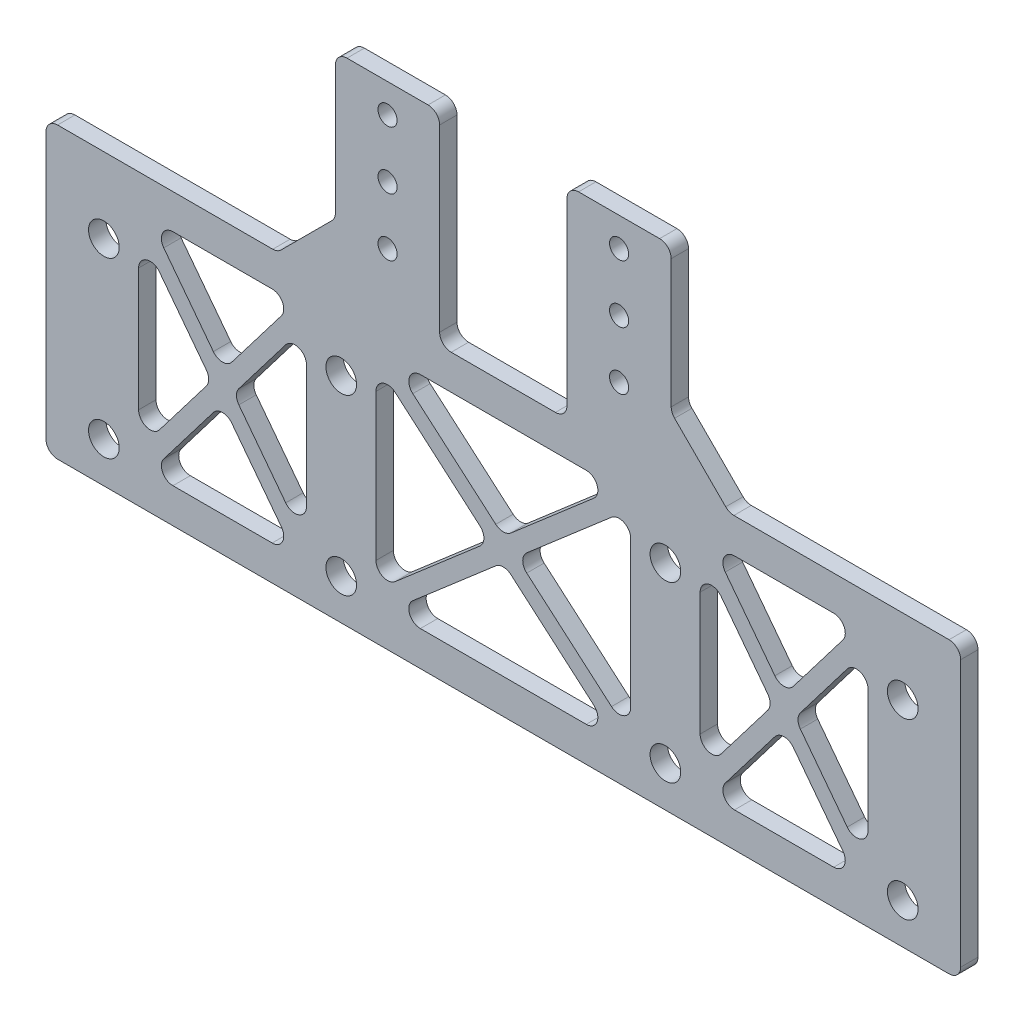
from build123d import *

# Parameters (mm, degrees)
SKETCH_1_R          = 1.55
SKETCH_1_R_2        = 2.65
SKETCH_1_W          = 29
SKETCH_1_H          = 38
SKETCH_1_W_2        = 44
EXTRUDE_1_DEPTH     = 3
SKETCH_4_W          = 20
SKETCH_4_H          = 35
CUT_EXTRUDE_1_DEPTH = 10
SKETCH_3_W          = 18
SKETCH_3_H          = 35
EXTRUDE_2_DEPTH     = 3
SKETCH_5_R          = 1.65
CUT_EXTRUDE_2_DEPTH = 5
CHAMFER_1_SIZE      = 10
FILLET_1_R          = 2
EXTRUDE_1_2_DEPTH   = 3
FILLET_3_R          = 2


with BuildPart() as part:
    # 草图1 → Extrude 1 (new body)
    with BuildSketch(Plane.XY):
        Polygon((-10, 50), (-10, 85), (10, 85), (10, 50), (79, 50), (79, 0), (-79, 0), (-79, 50), align=None)
        with Locations((-6, 81)):
            Circle(SKETCH_1_R, mode=Mode.SUBTRACT)
        with Locations(Location((6, 81, 0), (0, 0, 180))):
            Circle(SKETCH_1_R, mode=Mode.SUBTRACT)
        with Locations((-6, 59)):
            Circle(SKETCH_1_R, mode=Mode.SUBTRACT)
        with Locations(Location((6, 59, 0), (0, 0, 180))):
            Circle(SKETCH_1_R, mode=Mode.SUBTRACT)
        with Locations((-69, 37)):
            Circle(SKETCH_1_R_2, mode=Mode.SUBTRACT)
        with Locations((-69, 7)):
            Circle(SKETCH_1_R_2, mode=Mode.SUBTRACT)
        with Locations(Location((69, 7, 0), (0, 0, 180))):
            Circle(SKETCH_1_R_2, mode=Mode.SUBTRACT)
        with Locations(Location((69, 37, 0), (0, 0, 180))):
            Circle(SKETCH_1_R_2, mode=Mode.SUBTRACT)
        with Locations((-28, 37)):
            Circle(SKETCH_1_R_2, mode=Mode.SUBTRACT)
        with Locations((-28, 7)):
            Circle(SKETCH_1_R_2, mode=Mode.SUBTRACT)
        with Locations(Location((28, 7, 0), (0, 0, 180))):
            Circle(SKETCH_1_R_2, mode=Mode.SUBTRACT)
        with Locations(Location((28, 37, 0), (0, 0, 180))):
            Circle(SKETCH_1_R_2, mode=Mode.SUBTRACT)
        with Locations((-48.5, 25)):
            Rectangle(SKETCH_1_W, SKETCH_1_H, mode=Mode.SUBTRACT)
        with Locations((48.5, 25)):
            Rectangle(SKETCH_1_W, SKETCH_1_H, mode=Mode.SUBTRACT)
        with Locations((0, 25)):
            Rectangle(SKETCH_1_W_2, SKETCH_1_H, mode=Mode.SUBTRACT)
    extrude(amount=EXTRUDE_1_DEPTH)

    # 草图4 → 切除-拉伸1 (cut)
    with BuildSketch(Plane(origin=(0, 0, 0), x_dir=(-1, 0, 0), z_dir=(0, 0, -1))):
        with Locations((0, 67.5)):
            Rectangle(SKETCH_4_W, SKETCH_4_H)
    extrude(amount=-CUT_EXTRUDE_1_DEPTH, mode=Mode.SUBTRACT)

    # 草图3 → 凸台-拉伸2 (add)
    with BuildSketch(Plane(origin=(0, 0, 0), x_dir=(-1, 0, 0), z_dir=(0, 0, -1))):
        with Locations((-20, 67.5)):
            Rectangle(SKETCH_3_W, SKETCH_3_H)
        with Locations((20, 67.5)):
            Rectangle(SKETCH_3_W, SKETCH_3_H)
    extrude(amount=-EXTRUDE_2_DEPTH)

    # 草图5 → 切除-拉伸2 (cut)
    with BuildSketch(Plane(origin=(0, 0, 0), x_dir=(-1, 0, 0), z_dir=(0, 0, -1))):
        with Locations((-20, 80)):
            Circle(SKETCH_5_R)
        with Locations((-20, 70)):
            Circle(SKETCH_5_R)
        with Locations((-20, 60)):
            Circle(SKETCH_5_R)
        with Locations(Location((20, 60, 0), (0, 0, 180))):
            Circle(SKETCH_5_R)
        with Locations(Location((20, 70, 0), (0, 0, 180))):
            Circle(SKETCH_5_R)
        with Locations(Location((20, 80, 0), (0, 0, 180))):
            Circle(SKETCH_5_R)
    extrude(amount=-CUT_EXTRUDE_2_DEPTH, mode=Mode.SUBTRACT)

    # 倒角1
    chamfer_1_edges = [part.edges().sort_by_distance(p)[0] for p in [
        (29, 50, 1.5),
        (-29, 50, 1.5),
    ]]
    chamfer(chamfer_1_edges, length=CHAMFER_1_SIZE)

    # 圆角1
    fillet_1_edges = [part.edges().sort_by_distance(p)[0] for p in [
        (79, 50, 1.5),
        (79, 0, 1.5),
        (-79, 0, 1.5),
        (-79, 50, 1.5),
        (11, 85, 1.5),
        (11, 50, 1.5),
        (29, 85, 1.5),
        (-29, 85, 1.5),
        (-11, 50, 1.5),
        (-11, 85, 1.5),
        (-39, 50, 1.5),
        (-29, 60, 1.5),
        (29, 60, 1.5),
        (39, 50, 1.5),
    ]]
    fillet(fillet_1_edges, radius=FILLET_1_R)

    # 草图6 → Extrude 1 2 (add)
    with BuildSketch(Plane(origin=(0, 0, 0), x_dir=(-1, 0, 0), z_dir=(0, 0, -1))):
        Polygon((-64.192426869, 43.089990021), (-35.192426869, 5.089990021), (-32.807573131, 6.910009979), (-61.807573131, 44.910009979), align=None)
        Polygon((-35.192426869, 44.910009979), (-64.192426869, 6.910009979), (-61.807573131, 5.089990021), (-32.807573131, 43.089990021), align=None)
        Polygon((-22.980429806, 42.864765488), (21.019570194, 4.864765488), (22.980429806, 7.135234512), (-21.019570194, 45.135234512), align=None)
        Polygon((21.019570194, 45.135234512), (-22.980429806, 7.135234512), (-21.019570194, 4.864765488), (22.980429806, 42.864765488), align=None)
        Polygon((32.807573131, 43.089990021), (61.807573131, 5.089990021), (64.192426869, 6.910009979), (35.192426869, 44.910009979), align=None)
        Polygon((61.807573131, 44.910009979), (32.807573131, 6.910009979), (35.192426869, 5.089990021), (64.192426869, 43.089990021), align=None)
    extrude(amount=-EXTRUDE_1_2_DEPTH)

    # 圆角3
    fillet_3_edges = [part.edges().sort_by_distance(p)[0] for p in [
        (35.886908169, 44, 1.5),
        (61.113091831, 44, 1.5),
        (63, 8.472500359, 1.5),
        (63, 41.527499641, 1.5),
        (61.113091831, 6, 1.5),
        (35.886908169, 6, 1.5),
        (34, 41.527499641, 1.5),
        (34, 8.472500359, 1.5),
        (48.5, 22.527499641, 1.5),
        (48.5, 27.472500359, 1.5),
        (46.613091831, 25, 1.5),
        (50.386908169, 25, 1.5),
        (-19.705088128, 44, 1.5),
        (19.705088128, 44, 1.5),
        (22, 7.981969344, 1.5),
        (22, 42.018030656, 1.5),
        (19.705088128, 6, 1.5),
        (-19.705088128, 6, 1.5),
        (-22, 42.018030656, 1.5),
        (-22, 7.981969344, 1.5),
        (0, 23.018030656, 1.5),
        (0, 26.981969344, 1.5),
        (-2.294911872, 25, 1.5),
        (2.294911872, 25, 1.5),
        (-63, 41.527499641, 1.5),
        (-63, 8.472500359, 1.5),
        (-61.113091831, 44, 1.5),
        (-35.886908169, 44, 1.5),
        (-34, 8.472500359, 1.5),
        (-34, 41.527499641, 1.5),
        (-35.886908169, 6, 1.5),
        (-61.113091831, 6, 1.5),
        (-48.5, 22.527499641, 1.5),
        (-48.5, 27.472500359, 1.5),
        (-50.386908169, 25, 1.5),
        (-46.613091831, 25, 1.5),
    ]]
    fillet(fillet_3_edges, radius=FILLET_3_R)


solid = part.part
